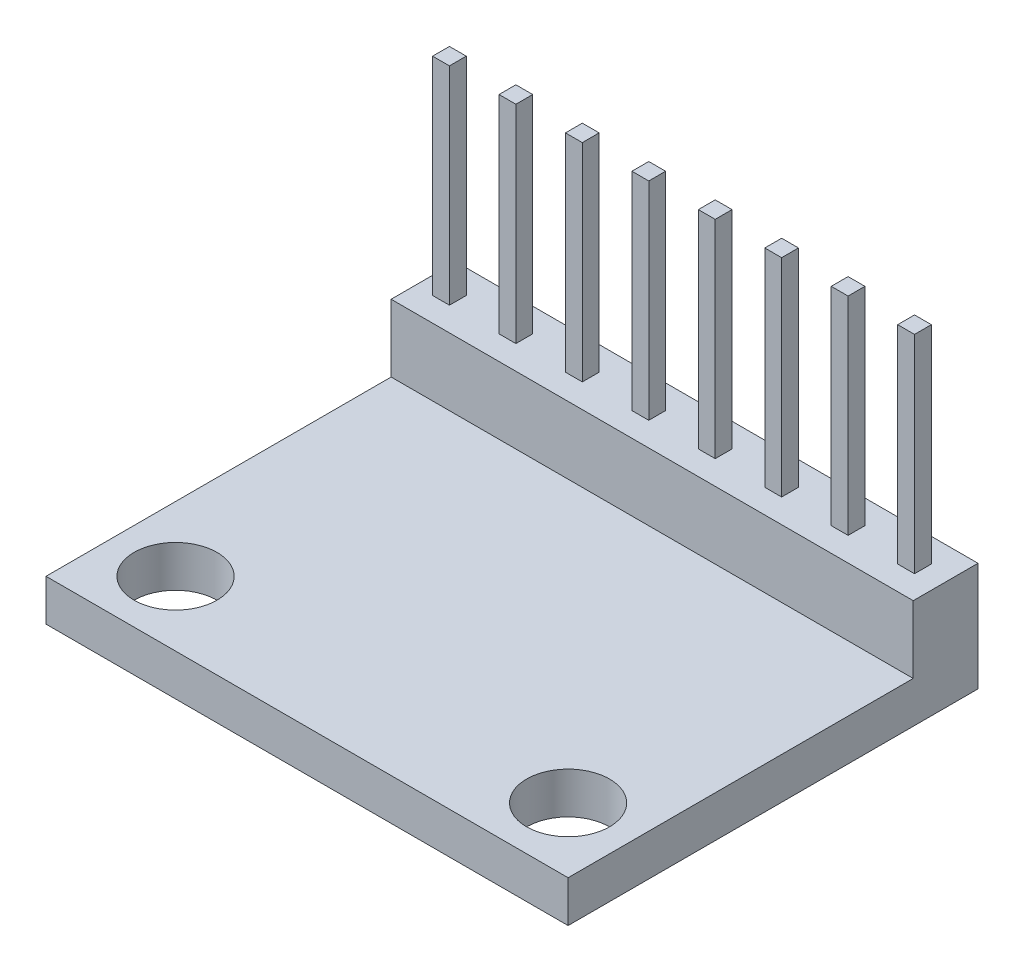
from build123d import *

# Parameters (mm, degrees)
SKETCH1_W           = 20.15
SKETCH1_H           = 15.82
BOSS_EXTRUDE1_DEPTH = 1.6
SKETCH2_R           = 1.6
CUT_EXTRUDE1_DEPTH  = 13.908668599
BOSS_EXTRUDE2_START = -1.6
SKETCH3_W           = 20.15
SKETCH3_H           = 2.5
BOSS_EXTRUDE2_DEPTH = 4.2
SKETCH5_W           = 0.65
SKETCH5_H           = 0.65
BOSS_EXTRUDE3_DEPTH = 8
LPATTERN1_COUNT     = 8
LPATTERN1_PITCH     = 2.564285714


with BuildPart() as part:
    # Sketch1 → Boss-Extrude1 (new body)
    with BuildSketch(Plane(origin=(0, 0, 0), x_dir=(1, 0, 0), z_dir=(0, 1, 0))):
        Rectangle(SKETCH1_W, SKETCH1_H)
    extrude(amount=BOSS_EXTRUDE1_DEPTH)

    # Sketch2 → Cut-Extrude1 (cut, through all)
    with BuildSketch(Plane(origin=(0, 1.6, 0), x_dir=(1, 0, 0), z_dir=(0, 1, 0))):
        with Locations(Location((-7.575, -5.41, 0), (0, 0, 270))):
            Circle(SKETCH2_R)
        with Locations(Location((7.575, -5.41, 0), (0, 0, 270))):
            Circle(SKETCH2_R)
    extrude(amount=-CUT_EXTRUDE1_DEPTH, mode=Mode.SUBTRACT)

    # Sketch3 → Boss-Extrude2 (add)
    with BuildSketch(Plane(origin=(0, 1.6, 0), x_dir=(1, 0, 0), z_dir=(0, 1, 0)).offset(BOSS_EXTRUDE2_START)):
        with Locations((0, 6.66)):
            Rectangle(SKETCH3_W, SKETCH3_H)
    extrude(amount=BOSS_EXTRUDE2_DEPTH)

    # Sketch5 → Boss-Extrude3 (add)
    with BuildSketch(Plane(origin=(0, 4.2, 0), x_dir=(1, 0, 0), z_dir=(0, 1, 0))):
        with Locations((-9.075, 6.66)):
            Rectangle(SKETCH5_W, SKETCH5_H)
    boss_extrude3 = extrude(amount=BOSS_EXTRUDE3_DEPTH)

    # LPattern1: Boss-Extrude3 ×8
    with Locations(*[(i * LPATTERN1_PITCH, 0, 0) for i in range(1, LPATTERN1_COUNT)]):
        add(boss_extrude3)


solid = part.part
